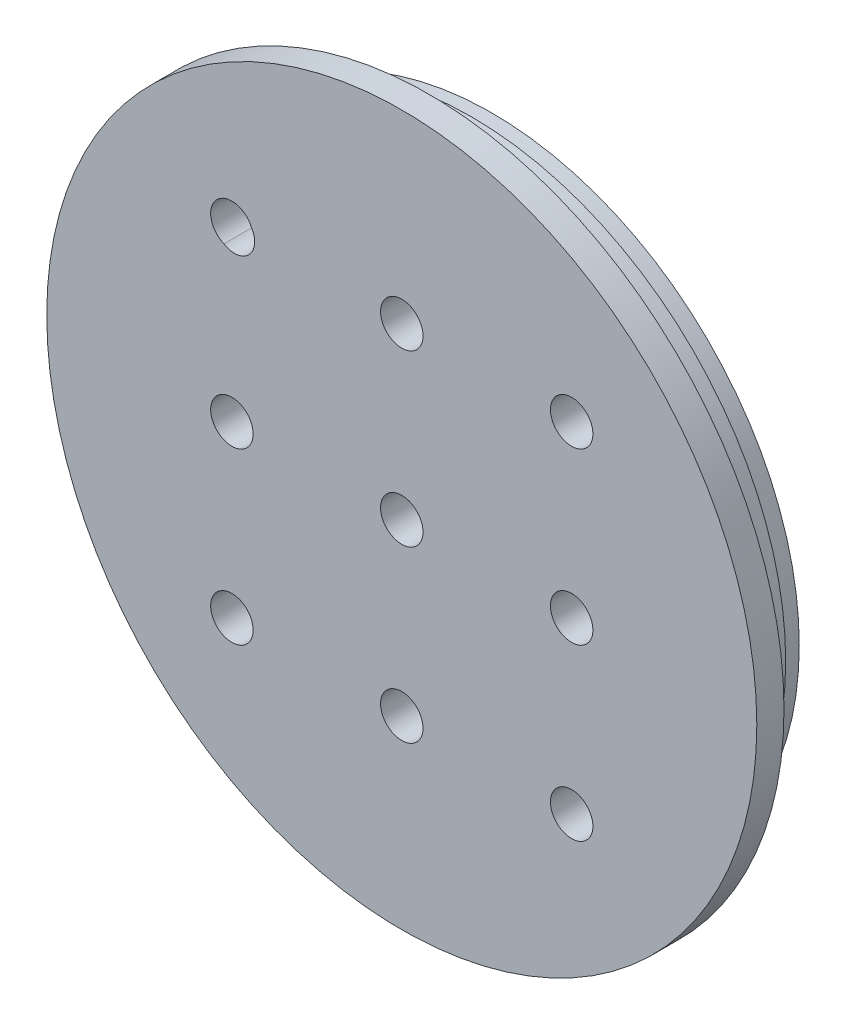
from build123d import *

# Parameters (mm, degrees)
SKETCH2_W                        = 127
SKETCH2_H                        = 127
HOUSING_DEPTH                    = 39.5
SKETCH3_R                        = 19.05
CUT_EXTRUDE1_DEPTH               = 99.105810225
SKETCH4_OUTSIDE_W                = 165.78
SKETCH4_OUTSIDE_H                = 165.78
SKETCH4_OUTSIDE_R                = 45.974
CUT_EXTRUDE2_DEPTH               = 4.698
MOUNTING_POCKETS_DEPTH           = 24.384
ENG_METRIC_SLOT_VERTICAL_REACH   = 160.723
ENG_METRIC_SLOT_HORIZONTAL_DEPTH = 199.381065075
FILLET3_R                        = 0.508
F_10_32_TAPPED_HOLE1_D           = 4.0386
F_10_32_TAPPED_HOLE1_DEPTH       = 12.02944
F_10_32_TAPPED_HOLE1_TIP         = 1.213317848
SKETCH219_R                      = 53.086
EXTRUDE2_DEPTH                   = 10.414
CUT_EXTRUDE6_START               = -6.35
SKETCH222_R                      = 53.086
SKETCH222_R_2                    = 46.99
CUT_EXTRUDE6_DEPTH               = 6.35
LPATTERN14_COUNT                 = 3
LPATTERN14_PITCH                 = 25.4
LPATTERN14_COUNT_DIR2            = 3
LPATTERN14_PITCH_DIR2            = 25.4
M6X1_0_TAPPED_HOLE1_D            = 5
M6X1_0_TAPPED_HOLE1_DEPTH        = 8
M6X1_0_TAPPED_HOLE1_CBORE_D      = 6
M6X1_0_TAPPED_HOLE1_CBORE_DEPTH  = 6
M6X1_0_TAPPED_HOLE1_TIP          = 1.502151548
SKETCH234_W                      = 34.802
SKETCH234_H                      = 127
CUT_EXTRUDE8_DEPTH               = 150.967588498


with BuildPart() as part:
    # Sketch2 → HOUSING (new body)
    with BuildSketch(Plane.XY):
        Rectangle(SKETCH2_W, SKETCH2_H)
    extrude(amount=HOUSING_DEPTH)

    # Sketch3 → Cut-Extrude1 (cut, through all)
    with BuildSketch(Plane.XY.offset(39.5)):
        Circle(SKETCH3_R)
    extrude(amount=-CUT_EXTRUDE1_DEPTH, mode=Mode.SUBTRACT)

    # Sketch4 outside → Cut-Extrude2 (cut)
    with BuildSketch(Plane.XY.offset(39.5)):
        Rectangle(SKETCH4_OUTSIDE_W, SKETCH4_OUTSIDE_H)
        Circle(SKETCH4_OUTSIDE_R, mode=Mode.SUBTRACT)
    extrude(amount=-CUT_EXTRUDE2_DEPTH, mode=Mode.SUBTRACT)

    # Sketch8 → MOUNTING POCKETS (cut)
    with BuildSketch(Plane.XY.offset(34.802)):
        with BuildLine():
            Line((3.048, -63.5), (3.048, -57.528018122))
            ThreePointArc((3.048, -57.528018122), (4.194729662, -53.888172274), (7.220748912, -51.562946647))
            Line((7.220748912, -51.562946647), (45.320748912, -37.656446647))
            ThreePointArc((45.320748912, -37.656446647), (51.137845848, -38.418247784), (53.848, -43.621518122))
            Line((53.848, -43.621518122), (53.848, -63.5))
            Line((53.848, -63.5), (3.048, -63.5))
        make_face()
        with BuildLine():
            Line((3.048, 63.5), (53.848, 63.5))
            Line((53.848, 63.5), (53.848, 43.621518122))
            ThreePointArc((53.848, 43.621518122), (51.137845848, 38.418247784), (45.320748912, 37.656446647))
            Line((45.320748912, 37.656446647), (7.220748912, 51.562946647))
            ThreePointArc((7.220748912, 51.562946647), (4.194729662, 53.888172274), (3.048, 57.528018122))
            Line((3.048, 57.528018122), (3.048, 63.5))
        make_face()
    extrude(amount=-MOUNTING_POCKETS_DEPTH, mode=Mode.SUBTRACT)

    # Sketch21 → ENG_METRIC SLOT VERTICAL (cut, up to next)
    with BuildSketch(Plane(origin=(63.5, -23.646142673, 1.166551585), x_dir=(0, 0, -1), z_dir=(1, 0, 0)), mode=Mode.PRIVATE) as eng_metric_slot_vertical_sk1:
        with BuildLine():
            Line((-20.641506099, 75.242113831), (-21.041506099, 76.042113831))
            ThreePointArc((-21.041506099, 76.042113831), (-25.829419573, 77.63808499), (-27.425390732, 72.850171515))
            Line((-27.425390732, 72.850171515), (-27.025390732, 72.050171515))
            ThreePointArc((-27.025390732, 72.050171515), (-22.237477257, 70.454200357), (-20.641506099, 75.242113831))
        make_face()
    eng_metric_slot_vertical_tool1 = extrude(eng_metric_slot_vertical_sk1.sketch, amount=-ENG_METRIC_SLOT_VERTICAL_REACH, mode=Mode.PRIVATE) & part.part
    # Sketch21 → ENG_METRIC SLOT VERTICAL (cut, up to next)
    with BuildSketch(Plane(origin=(63.5, -23.646142673, 1.166551585), x_dir=(0, 0, -1), z_dir=(1, 0, 0)), mode=Mode.PRIVATE) as eng_metric_slot_vertical_sk2:
        with BuildLine():
            Line((-27.025390732, -24.757886169), (-27.425390732, -25.557886169))
            ThreePointArc((-27.425390732, -25.557886169), (-25.829419573, -30.345799643), (-21.041506099, -28.749828485))
            Line((-21.041506099, -28.749828485), (-20.641506099, -27.949828485))
            ThreePointArc((-20.641506099, -27.949828485), (-22.237477257, -23.16191501), (-27.025390732, -24.757886169))
        make_face()
    eng_metric_slot_vertical_tool2 = extrude(eng_metric_slot_vertical_sk2.sketch, amount=-ENG_METRIC_SLOT_VERTICAL_REACH, mode=Mode.PRIVATE) & part.part
    add(eng_metric_slot_vertical_tool1.solids().sort_by_distance((63.5, 50.4, 25.2))[0], mode=Mode.SUBTRACT)
    add(eng_metric_slot_vertical_tool2.solids().sort_by_distance((63.5, -50.4, 25.2))[0], mode=Mode.SUBTRACT)

    # Sketch212 → ENG_METRIC SLOT HORIZONTAL (cut, through all)
    with BuildSketch(Plane(origin=(34.062086582, -104.655987826, 0), x_dir=(-1, 0, 0), z_dir=(0, 0, -1))):
        with BuildLine():
            Line((12.254028899, 156.251958985), (11.854028899, 157.051958985))
            ThreePointArc((11.854028899, 157.051958985), (7.066115424, 158.647930143), (5.470144266, 153.860016668))
            Line((5.470144266, 153.860016668), (5.870144266, 153.060016668))
            ThreePointArc((5.870144266, 153.060016668), (10.658057741, 151.46404551), (12.254028899, 156.251958985))
        make_face()
        with BuildLine():
            Line((5.870144266, 56.251958985), (5.470144266, 55.451958985))
            ThreePointArc((5.470144266, 55.451958985), (7.066115424, 50.66404551), (11.854028899, 52.260016668))
            Line((11.854028899, 52.260016668), (12.254028899, 53.060016668))
            ThreePointArc((12.254028899, 53.060016668), (10.658057741, 57.847930143), (5.870144266, 56.251958985))
        make_face()
    extrude(amount=-ENG_METRIC_SLOT_HORIZONTAL_DEPTH, mode=Mode.SUBTRACT)

    # Fillet3
    fillet3_edges = [part.edges().sort_by_distance(p)[0] for p in [
        (3.048, -60.514009061, 10.418),
        (4.194729662, -53.888172274, 10.418),
        (26.270748912, -44.609696647, 10.418),
        (51.137845848, -38.418247784, 10.418),
        (53.848, -53.560759061, 10.418),
        (51.137845848, 38.418247784, 10.418),
        (26.270748912, 44.609696647, 10.418),
        (4.194729662, 53.888172274, 10.418),
        (3.048, 60.514009061, 10.418),
        (53.848, 53.560759061, 10.418),
    ]]
    fillet(fillet3_edges, radius=FILLET3_R)

    # #10-32 Tapped Hole1
    with Locations(Plane.XY.offset(39.5)):
        with Locations((26.9875, -26.9875), (26.9875, 26.9875), (-26.9875, 26.9875), (-26.9875, -26.9875)):
            Hole(F_10_32_TAPPED_HOLE1_D / 2, depth=F_10_32_TAPPED_HOLE1_DEPTH)
            with Locations((0, 0, -(F_10_32_TAPPED_HOLE1_DEPTH + F_10_32_TAPPED_HOLE1_TIP / 2))):  # 118° drill point
                Cone(0, F_10_32_TAPPED_HOLE1_D / 2, F_10_32_TAPPED_HOLE1_TIP, mode=Mode.SUBTRACT)

    # Sketch219 → Extrude2 (add)
    with BuildSketch(Plane.XY.offset(48.26)):
        Circle(SKETCH219_R)
    extrude(amount=-EXTRUDE2_DEPTH)

    # Sketch222 → Cut-Extrude6 (cut)
    with BuildSketch(Plane(origin=(0, 0, 37.846), x_dir=(-1, 0, 0), z_dir=(0, 0, -1)).offset(CUT_EXTRUDE6_START)):
        with Locations(Location((0, 0, 0), (0, 0, 180))):
            Circle(SKETCH222_R)
        Circle(SKETCH222_R_2, mode=Mode.SUBTRACT)
    extrude(amount=CUT_EXTRUDE6_DEPTH, mode=Mode.SUBTRACT)

    # Sketch230 → 1/4-20 Tapped Hole2 (revolve, cut)
    with BuildSketch(Plane(origin=(-25.4, 25.4, 48.26), x_dir=(0, -1, 0), z_dir=(1, 0, 0))):
        Polygon((0, 0), (0, 9.533816902), (2.5527, 8), (2.5527, 6), (3.175, 6), (3.175, 0), align=None)
    f_1_4_20_tapped_hole2 = revolve(axis=Axis((-25.4, 25.4, 54.61), (0, 0, -1)), mode=Mode.SUBTRACT)

    # LPattern14: 1_4-20 Tapped Hole2 3 × 3
    with Locations(*[(i * LPATTERN14_PITCH, -j * LPATTERN14_PITCH_DIR2, 0) for i in range(LPATTERN14_COUNT) for j in range(LPATTERN14_COUNT_DIR2) if (i, j) != (0, 0)]):
        add(f_1_4_20_tapped_hole2, mode=Mode.SUBTRACT)

    # M6x1.0 Tapped Hole1
    with Locations(Plane.XY.offset(48.26)):
        with Locations((-25, 25)):
            CounterBoreHole(M6X1_0_TAPPED_HOLE1_D / 2, M6X1_0_TAPPED_HOLE1_CBORE_D / 2, M6X1_0_TAPPED_HOLE1_CBORE_DEPTH, depth=M6X1_0_TAPPED_HOLE1_DEPTH)
            with Locations((0, 0, -(M6X1_0_TAPPED_HOLE1_DEPTH + M6X1_0_TAPPED_HOLE1_TIP / 2))):  # 118° drill point
                Cone(0, M6X1_0_TAPPED_HOLE1_D / 2, M6X1_0_TAPPED_HOLE1_TIP, mode=Mode.SUBTRACT)

    # Sketch234 → Cut-Extrude8 (cut, through all)
    with BuildSketch(Plane.ZY.offset(63.5)):
        with Locations((17.401, 0)):
            Rectangle(SKETCH234_W, SKETCH234_H)
    extrude(amount=-CUT_EXTRUDE8_DEPTH, mode=Mode.SUBTRACT)


solid = part.part
